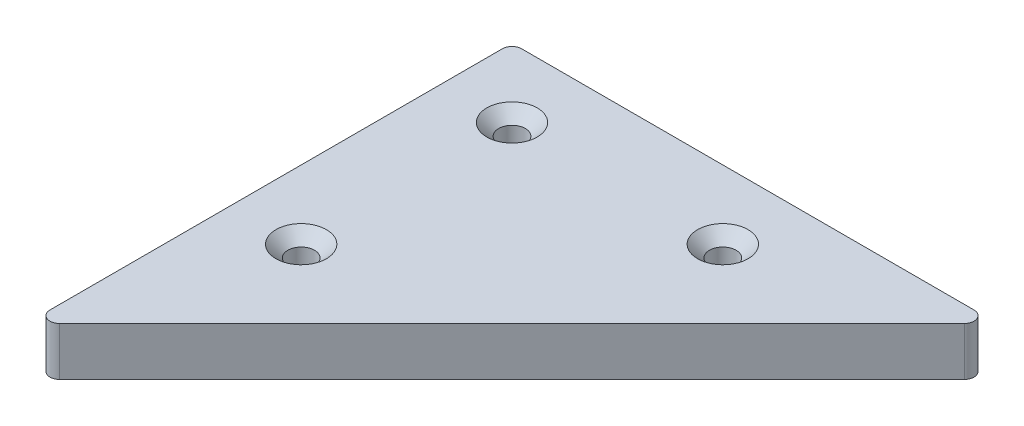
from build123d import *

# Parameters (mm, degrees)
BOSS_EXTRUDE1_DEPTH                             = 10
CSK_FOR_M5_FLAT_HEAD_MACHINE_SCREW1_D           = 5.5
CSK_FOR_M5_FLAT_HEAD_MACHINE_SCREW1_CSINK_D     = 10.4
CSK_FOR_M5_FLAT_HEAD_MACHINE_SCREW1_CSINK_ANGLE = 90
FILLET2_R                                       = 2


with BuildPart() as part:
    # Sketch1 → Boss-Extrude1 (new body)
    with BuildSketch(Plane(origin=(0, 0, 0), x_dir=(1, 0, 0), z_dir=(0, 1, 0))):
        Polygon((0, 0), (0, -100), (100, 0), align=None)
    extrude(amount=BOSS_EXTRUDE1_DEPTH)

    # CSK for M5 Flat Head Machine Screw1 (through all)
    with Locations(Plane(origin=(14.142135624, 10, 14.142135624), x_dir=(0, 0, 1), z_dir=(0, 1, 0))):
        with Locations((0, 0), (43.431457505, 0), (0, 43.431457505)):
            CounterSinkHole(CSK_FOR_M5_FLAT_HEAD_MACHINE_SCREW1_D / 2, CSK_FOR_M5_FLAT_HEAD_MACHINE_SCREW1_CSINK_D / 2, counter_sink_angle=CSK_FOR_M5_FLAT_HEAD_MACHINE_SCREW1_CSINK_ANGLE)

    # Fillet2
    fillet2_edges = [part.edges().sort_by_distance(p)[0] for p in [
        (100, 5, 0),
        (0, 5, 100),
        (0, 5, 0),
    ]]
    fillet(fillet2_edges, radius=FILLET2_R)


solid = part.part
